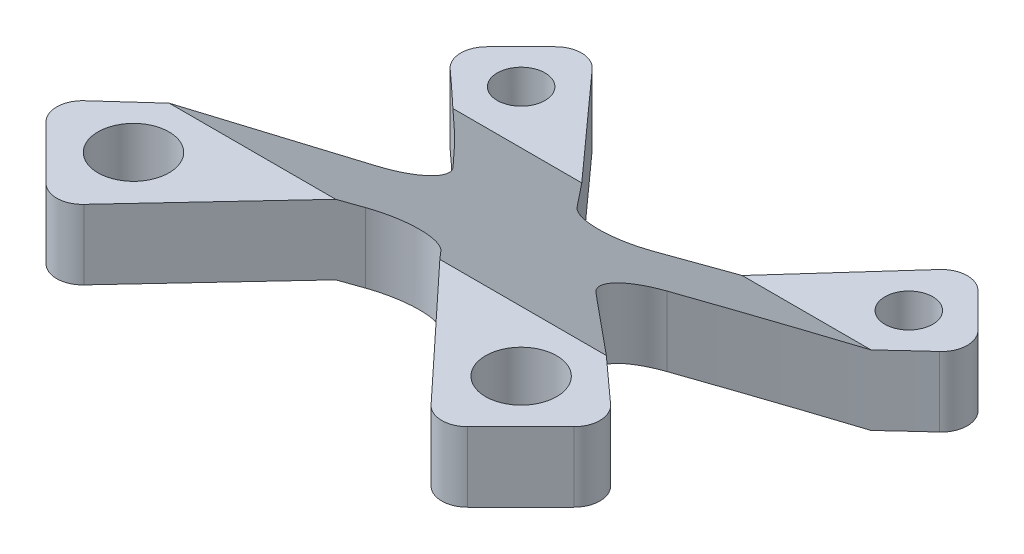
from build123d import *

# Parameters (mm, degrees)
BOSS_EXTRUDE1_DEPTH      = 4
BOSS_EXTRUDE1_DEPTH_BACK = 4
SKETCH1_R                = 1.375
SKETCH1_R_2              = 0.925
CUT_EXTRUDE1_DEPTH       = 29.461459085
CUT_EXTRUDE1_DEPTH_BACK  = 29.461459085
FILLET1_R                = 2
FILLET2_R                = 1


with BuildPart() as part:
    # Sketch1 → Boss-Extrude1 (new, two sides: drawn at the far end of the back side and taken through both)
    with BuildSketch(Plane(origin=(0, 0, 0), x_dir=(1, 0, 0), z_dir=(0, 1, 0)).offset(-BOSS_EXTRUDE1_DEPTH_BACK)):
        with BuildLine():
            Line((0, 2), (-7.424621202, 10.253048327))
            Line((-7.424621202, 10.253048327), (-10.253048327, 7.424621202))
            ThreePointArc((-10.253048327, 7.424621202), (-6.398566018, 3.816356305), (-2.75, 0))
            Line((-2.75, 0), (-10.960155108, -7.424621202))
            Line((-10.960155108, -7.424621202), (-7.424621202, -10.960155108))
            Line((-7.424621202, -10.960155108), (0, -3))
            Line((0, -3), (0, 0))
            Line((0, 0), (0, 2))
        make_face()
        with Locations((-7.5, -7.5)):
            Circle(SKETCH1_R, mode=Mode.SUBTRACT)
        with Locations((-7.5, 7.5)):
            Circle(SKETCH1_R_2, mode=Mode.SUBTRACT)
    extrude(amount=BOSS_EXTRUDE1_DEPTH + BOSS_EXTRUDE1_DEPTH_BACK)

    # Mirror2: part across plane


with BuildPart() as part_1:
    add(part.part)
    add(part.part.mirror(Plane(origin=(0, -4, 0), x_dir=(0, 0, 1), z_dir=(-1, 0, 0))))

    # Sketch3 → Cut-Extrude1 (cut, two sides: drawn at the far end of the back side and taken through both)
    with BuildSketch(Plane(origin=(-15, 0, 0), x_dir=(0, 0, -1), z_dir=(1, 0, 0)).offset(-CUT_EXTRUDE1_DEPTH_BACK)):
        Polygon((5.45, -1.3), (10.25, -1.3), (10.25, 4), (-5.16, 4), align=None)
        Polygon((-10.96, -4), (5.45, -4), (-5.16, 1.3), (-10.96, 1.3), align=None)
    extrude(amount=CUT_EXTRUDE1_DEPTH + CUT_EXTRUDE1_DEPTH_BACK, mode=Mode.SUBTRACT)

    # Fillet1
    fillet1_edges = [part_1.edges().sort_by_distance(p)[0] for p in [
        (2.75, 0.072431668, 0),
        (-2.75, 0.072431668, 0),
        (0, -0.926625825, -2),
        (0, 1.571017908, 3),
    ]]
    fillet(fillet1_edges, radius=FILLET1_R)

    # Fillet2
    fillet2_edges = [part_1.edges().sort_by_distance(p)[0] for p in [
        (-7.424621202, 0, -10.253048327),
        (-10.253048327, -2.65, -7.424621202),
        (7.424621202, 0, -10.253048327),
        (10.253048327, -2.65, -7.424621202),
        (10.960155108, 2.65, 7.424621202),
        (7.424621202, 0, 10.960155108),
        (-10.960155108, 2.65, 7.424621202),
        (-7.424621202, 0, 10.960155108),
    ]]
    fillet(fillet2_edges, radius=FILLET2_R)


solid = part_1.part
